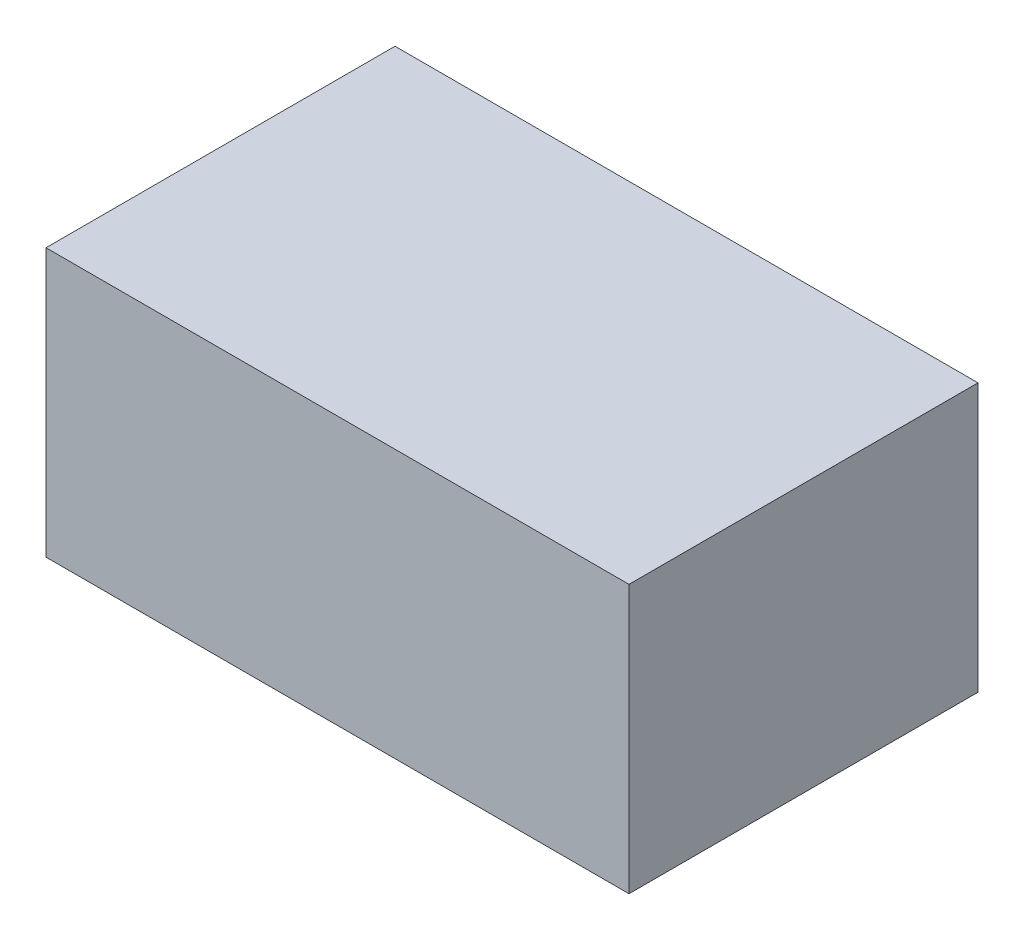
from build123d import *

# Parameters (mm, degrees)
SKETCH1_W      = 44.6
SKETCH1_H      = 20.5
ENVELOPE_DEPTH = 26.7


with BuildPart() as part:
    # Sketch1 → Envelope (new body)
    with BuildSketch(Plane.XY):
        Rectangle(SKETCH1_W, SKETCH1_H)
    extrude(amount=ENVELOPE_DEPTH)


solid = part.part
